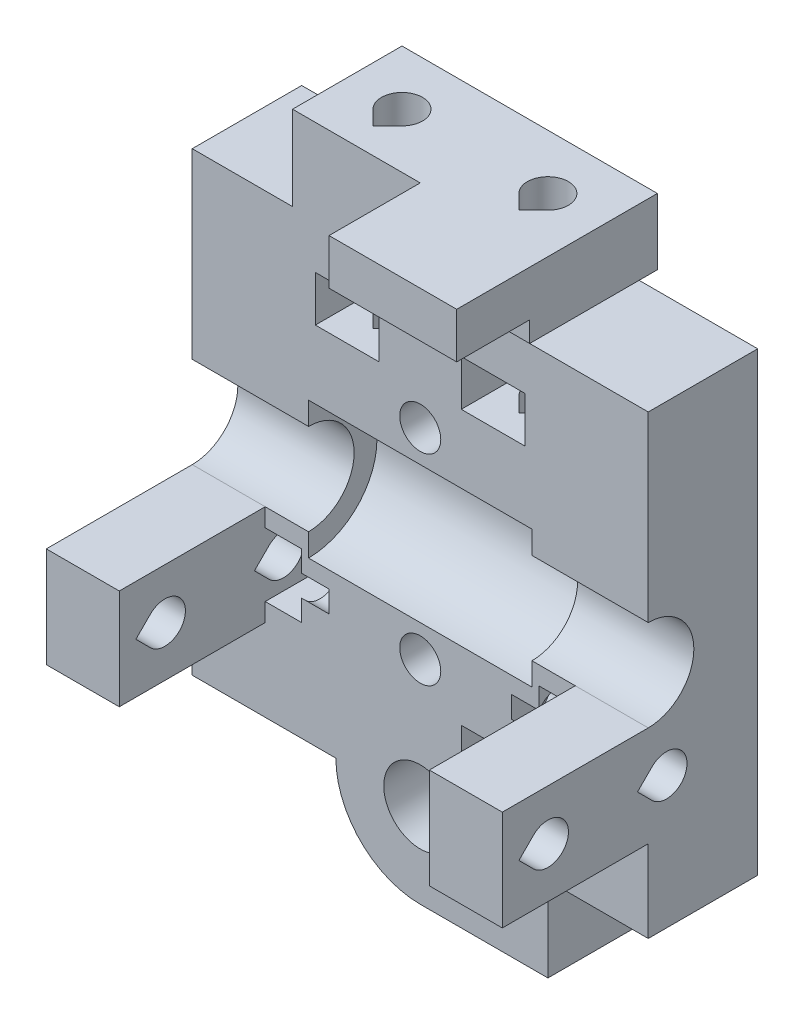
from build123d import *

# Parameters (mm, degrees)
SKETCH1_W           = 50
SKETCH1_H           = 50
BOSS_EXTRUDE1_DEPTH = 12
SKETCH2_R           = 5
CUT_EXTRUDE1_DEPTH  = 58.175169436
CUT_EXTRUDE2_START  = -12.75
SKETCH3_R           = 7.5
CUT_EXTRUDE2_DEPTH  = 24.5
SKETCH4_R           = 2.25
CUT_EXTRUDE3_DEPTH  = 38.336309405
SKETCH5_R           = 4
CUT_EXTRUDE4_DEPTH  = 38.336309405
BOSS_EXTRUDE3_DEPTH = 12
CUT_EXTRUDE5_START  = -15
CUT_EXTRUDE5_DEPTH  = 73.175169436
SKETCH7_W           = 7
SKETCH7_H           = 5
CUT_EXTRUDE6_DEPTH  = 45.068838197
SKETCH13_W          = 10
SKETCH13_H          = 7.25
BOSS_EXTRUDE4_DEPTH = 2
SKETCH14_W          = 14
SKETCH14_H          = 5
BOSS_EXTRUDE5_DEPTH = 10
SKETCH8_W           = 16
SKETCH8_H           = 11
BOSS_EXTRUDE2_DEPTH = 8
CUT_EXTRUDE7_DEPTH  = 15
SKETCH10_W          = 4
SKETCH10_H          = 7
CUT_EXTRUDE8_DEPTH  = 7
CUT_EXTRUDE9_DEPTH  = 4
SKETCH15_W          = 7
SKETCH15_H          = 5
CUT_EXTRUDE10_DEPTH = 46.321766294
BOSS_EXTRUDE6_DEPTH = 12
CUT_EXTRUDE11_REACH = 80.11
SKETCH18_W          = 10
SKETCH18_H          = 18.25
CUT_EXTRUDE12_DEPTH = 59.975100678


with BuildPart() as part:
    # Sketch1 → Boss-Extrude1 (new body)
    with BuildSketch(Plane.XY):
        Rectangle(SKETCH1_W, SKETCH1_H)
    extrude(amount=BOSS_EXTRUDE1_DEPTH)

    # Sketch2 → Cut-Extrude1 (cut, through all)
    with BuildSketch(Plane.ZY.offset(25)):
        with Locations((12, 0)):
            Circle(SKETCH2_R)
    extrude(amount=-CUT_EXTRUDE1_DEPTH, mode=Mode.SUBTRACT)

    # Sketch3 → Cut-Extrude2 (cut)
    with BuildSketch(Plane.ZY.offset(25).offset(CUT_EXTRUDE2_START)):
        with Locations((12, 0)):
            Circle(SKETCH3_R)
    extrude(amount=-CUT_EXTRUDE2_DEPTH, mode=Mode.SUBTRACT)

    # Sketch4 → Cut-Extrude3 (cut, through all)
    with BuildSketch(Plane.XY.offset(12)):
        with Locations((0, 11)):
            Circle(SKETCH4_R)
        with Locations((0, -11)):
            Circle(SKETCH4_R)
    extrude(amount=-CUT_EXTRUDE3_DEPTH, mode=Mode.SUBTRACT)

    # Sketch5 → Cut-Extrude4 (cut, through all)
    with BuildSketch(Plane.XY.offset(12)):
        with Locations((0, 25)):
            Circle(SKETCH5_R)
        with Locations((0, -25)):
            Circle(SKETCH5_R)
    extrude(amount=-CUT_EXTRUDE4_DEPTH, mode=Mode.SUBTRACT)

    # Sketch11 → Boss-Extrude3 (add)
    with BuildSketch(Plane.XY.offset(12)):
        with BuildLine():
            Line((3.464101615, 27), (14, 27))
            Line((14, 27), (14, 34.25))
            Line((14, 34.25), (0, 34.25))
            ThreePointArc((0, 34.25), (-6.540737726, 31.540737726), (-9.25, 25))
            Line((-9.25, 25), (-4, 25))
            ThreePointArc((-4, 25), (-1.03527618, 28.863703305), (3.464101615, 27))
        make_face()
    boss_extrude3 = extrude(amount=-BOSS_EXTRUDE3_DEPTH)

    # Sketch6 → Cut-Extrude5 (cut)
    with BuildSketch(Plane(origin=(0, 25, 0), x_dir=(1, 0, 0), z_dir=(0, 1, 0)).offset(CUT_EXTRUDE5_START)):
        with BuildLine():
            Line((6.409009742, -7.590990258), (8, -9.181980515))
            Line((8, -9.181980515), (9.590990258, -7.590990258))
            ThreePointArc((9.590990258, -7.590990258), (8, -3.75), (6.409009742, -7.590990258))
        make_face()
    cut_extrude5 = extrude(amount=CUT_EXTRUDE5_DEPTH, mode=Mode.SUBTRACT)

    # Sketch7 → Cut-Extrude6 (cut, through all)
    with BuildSketch(Plane.XY.offset(12)):
        with Locations((8, 17.5)):
            Rectangle(SKETCH7_W, SKETCH7_H)
    cut_extrude6 = extrude(amount=-CUT_EXTRUDE6_DEPTH, mode=Mode.SUBTRACT)

    # Sketch13 → Boss-Extrude4 (add)
    with BuildSketch(Plane.XY.offset(12)):
        with Locations((9, 30.625)):
            Rectangle(SKETCH13_W, SKETCH13_H)
    boss_extrude4 = extrude(amount=BOSS_EXTRUDE4_DEPTH)

    # Sketch14 → Boss-Extrude5 (add)
    with BuildSketch(Plane.XY.offset(12)):
        with Locations((7, 31.75)):
            Rectangle(SKETCH14_W, SKETCH14_H)
    boss_extrude5 = extrude(amount=BOSS_EXTRUDE5_DEPTH)

    # Mirror1: Boss-Extrude3, Cut-Extrude5, Cut-Extrude6, Boss-Extrude4, Boss-Extrude5 across plane
    add(boss_extrude3.mirror(Plane.ZX))
    add(cut_extrude5.mirror(Plane.ZX), mode=Mode.SUBTRACT)
    add(cut_extrude6.mirror(Plane.ZX), mode=Mode.SUBTRACT)
    add(boss_extrude4.mirror(Plane.ZX))
    add(boss_extrude5.mirror(Plane.ZX))

    # Sketch8 → Boss-Extrude2 (add)
    with BuildSketch(Plane.ZY.offset(25)):
        with Locations((20, -10.5)):
            Rectangle(SKETCH8_W, SKETCH8_H)
    boss_extrude2 = extrude(amount=-BOSS_EXTRUDE2_DEPTH)

    # Sketch9 → Cut-Extrude7 (cut)
    with BuildSketch(Plane.ZY.offset(25)):
        with BuildLine():
            Line((11.590990258, -8.909009742), (13.181980515, -10.5))
            Line((13.181980515, -10.5), (11.590990258, -12.090990258))
            ThreePointArc((11.590990258, -12.090990258), (7.75, -10.5), (11.590990258, -8.909009742))
        make_face()
        with BuildLine():
            Line((24.590990258, -8.909009742), (26.181980515, -10.5))
            Line((26.181980515, -10.5), (24.590990258, -12.090990258))
            ThreePointArc((24.590990258, -12.090990258), (20.75, -10.5), (24.590990258, -8.909009742))
        make_face()
    cut_extrude7 = extrude(amount=-CUT_EXTRUDE7_DEPTH, mode=Mode.SUBTRACT)

    # Sketch10 → Cut-Extrude8 (cut)
    with BuildSketch(Plane.XY.offset(12)):
        with Locations((-15, -10.5)):
            Rectangle(SKETCH10_W, SKETCH10_H)
    cut_extrude8 = extrude(amount=-CUT_EXTRUDE8_DEPTH, mode=Mode.SUBTRACT)

    # Mirror2: Boss-Extrude2, Cut-Extrude7, Cut-Extrude8 across plane
    add(boss_extrude2.mirror(Plane(origin=(0, 0, 0), x_dir=(0, 0, 1), z_dir=(1, 0, 0))))
    add(cut_extrude7.mirror(Plane(origin=(0, 0, 0), x_dir=(0, 0, 1), z_dir=(1, 0, 0))), mode=Mode.SUBTRACT)
    add(cut_extrude8.mirror(Plane(origin=(0, 0, 0), x_dir=(0, 0, 1), z_dir=(1, 0, 0))), mode=Mode.SUBTRACT)

    # Sketch12 → Cut-Extrude9 (cut)
    with BuildSketch(Plane(origin=(0, -34.25, 0), x_dir=(1, 0, 0), z_dir=(0, 1, 0))):
        with BuildLine():
            Line((5.171572875, -8.828427125), (8, -11.656854249))
            Line((8, -11.656854249), (10.828427125, -8.828427125))
            ThreePointArc((10.828427125, -8.828427125), (8, -2), (5.171572875, -8.828427125))
        make_face()
    extrude(amount=CUT_EXTRUDE9_DEPTH, mode=Mode.SUBTRACT)

    # Sketch15 → Cut-Extrude10 (cut, through all)
    with BuildSketch(Plane.XY.offset(12)):
        with Locations((-8, 17.5)):
            Rectangle(SKETCH15_W, SKETCH15_H)
    extrude(amount=-CUT_EXTRUDE10_DEPTH, mode=Mode.SUBTRACT)

    # Sketch16 → Boss-Extrude6 (add)
    with BuildSketch(Plane.XY.offset(12)):
        with BuildLine():
            Line((-14, 25), (-4, 25))
            ThreePointArc((-4, 25), (-2.828427125, 27.828427125), (0, 29))
            Line((0, 29), (0, 34.25))
            Line((0, 34.25), (-14, 34.25))
            Line((-14, 34.25), (-14, 25))
        make_face()
    extrude(amount=-BOSS_EXTRUDE6_DEPTH)

    # Cut-Extrude11: up to this face of the body (flat: up to its plane)
    cut_extrude11_end = Plane(part.part.faces().sort_by_distance((8, 10, 6.158015302))[0])
    # Sketch17 → Cut-Extrude11 (cut, up to the picked face)
    with BuildSketch(Plane(origin=(0, 34.25, 0), x_dir=(1, 0, 0), z_dir=(0, 1, 0)), mode=Mode.PRIVATE) as cut_extrude11_sk1:
        with BuildLine():
            Line((-9.590990258, -7.590990258), (-8, -9.181980515))
            Line((-8, -9.181980515), (-6.409009742, -7.590990258))
            ThreePointArc((-6.409009742, -7.590990258), (-8, -3.75), (-9.590990258, -7.590990258))
        make_face()
    cut_extrude11_tool1 = split(extrude(cut_extrude11_sk1.sketch, amount=-CUT_EXTRUDE11_REACH, mode=Mode.PRIVATE), bisect_by=cut_extrude11_end, keep=Keep.BOTH, mode=Mode.PRIVATE)
    add(cut_extrude11_tool1.solids().sort_by(Axis((-8, 34.25, 6.158015), (0, -1, 0)))[0], mode=Mode.SUBTRACT)

    # Sketch18 → Cut-Extrude12 (cut, through all)
    with BuildSketch(Plane(origin=(14, 0, 0), x_dir=(0, 0, -1), z_dir=(1, 0, 0))):
        with Locations((-17, -25.125)):
            Rectangle(SKETCH18_W, SKETCH18_H)
    extrude(amount=-CUT_EXTRUDE12_DEPTH, mode=Mode.SUBTRACT)


solid = part.part
